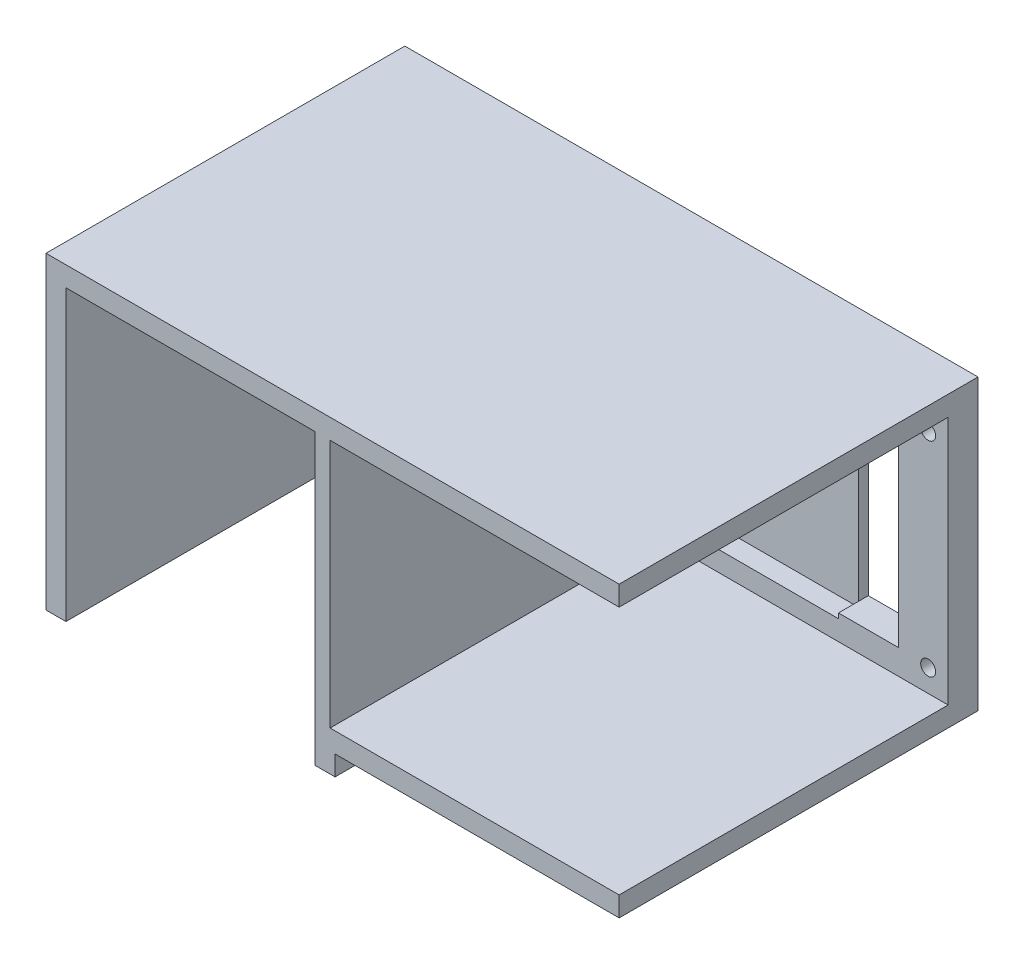
from build123d import *

# Parameters (mm, degrees)
EXTRUDE_1_DEPTH     = 3
CUT_EXTRUDE_1_REACH = 67.393
SKETCH_2_R          = 0.75
CUT_EXTRUDE_3_REACH = 67.393
SKETCH_4_W          = 20
SKETCH_4_H          = 6
CUT_EXTRUDE_4_REACH = 67.393
SKETCH_5_W          = 6
SKETCH_5_H          = 20
SKETCH_7_W          = 21
SKETCH_7_H          = 2
CUT_EXTRUDE_6_DEPTH = 13
SKETCH_8_W          = 2
SKETCH_8_H          = 21
CUT_EXTRUDE_7_DEPTH = 13
SKETCH_9_W          = 1.5
SKETCH_9_H          = 25
EXTRUDE_2_DEPTH     = 33


with BuildPart() as part:
    # 草图1 → 凸台-拉伸1 (new body)
    with BuildSketch(Plane.XY):
        Polygon((0, 0), (57.5, 0), (57.5, -29), (29, -29), (29, -31), (0, -31), align=None)
    extrude(amount=EXTRUDE_1_DEPTH)

    # 草图2 → 切除-拉伸1 (cut, up to next)
    with BuildSketch(Plane.XY.offset(3), mode=Mode.PRIVATE) as cut_extrude_1_sk1:
        with Locations((31.05, -4.25)):
            Circle(SKETCH_2_R)
    cut_extrude_1_tool1 = extrude(cut_extrude_1_sk1.sketch, amount=-CUT_EXTRUDE_1_REACH, mode=Mode.PRIVATE) & part.part
    # 草图2 → 切除-拉伸1 (cut, up to next)
    with BuildSketch(Plane.XY.offset(3), mode=Mode.PRIVATE) as cut_extrude_1_sk2:
        with Locations((55.5, -4.25)):
            Circle(SKETCH_2_R)
    cut_extrude_1_tool2 = extrude(cut_extrude_1_sk2.sketch, amount=-CUT_EXTRUDE_1_REACH, mode=Mode.PRIVATE) & part.part
    # 草图2 → 切除-拉伸1 (cut, up to next)
    with BuildSketch(Plane.XY.offset(3), mode=Mode.PRIVATE) as cut_extrude_1_sk3:
        with Locations((31.05, -24.75)):
            Circle(SKETCH_2_R)
    cut_extrude_1_tool3 = extrude(cut_extrude_1_sk3.sketch, amount=-CUT_EXTRUDE_1_REACH, mode=Mode.PRIVATE) & part.part
    # 草图2 → 切除-拉伸1 (cut, up to next)
    with BuildSketch(Plane.XY.offset(3), mode=Mode.PRIVATE) as cut_extrude_1_sk4:
        with Locations((55.5, -24.75)):
            Circle(SKETCH_2_R)
    cut_extrude_1_tool4 = extrude(cut_extrude_1_sk4.sketch, amount=-CUT_EXTRUDE_1_REACH, mode=Mode.PRIVATE) & part.part
    # 草图2 → 切除-拉伸1 (cut, up to next)
    with BuildSketch(Plane.XY.offset(3), mode=Mode.PRIVATE) as cut_extrude_1_sk5:
        with Locations((4.25, -29)):
            Circle(SKETCH_2_R)
    cut_extrude_1_tool5 = extrude(cut_extrude_1_sk5.sketch, amount=-CUT_EXTRUDE_1_REACH, mode=Mode.PRIVATE) & part.part
    # 草图2 → 切除-拉伸1 (cut, up to next)
    with BuildSketch(Plane.XY.offset(3), mode=Mode.PRIVATE) as cut_extrude_1_sk6:
        with Locations((24.75, -29)):
            Circle(SKETCH_2_R)
    cut_extrude_1_tool6 = extrude(cut_extrude_1_sk6.sketch, amount=-CUT_EXTRUDE_1_REACH, mode=Mode.PRIVATE) & part.part
    # 草图2 → 切除-拉伸1 (cut, up to next)
    with BuildSketch(Plane.XY.offset(3), mode=Mode.PRIVATE) as cut_extrude_1_sk7:
        with Locations((4.25, -4.55)):
            Circle(SKETCH_2_R)
    cut_extrude_1_tool7 = extrude(cut_extrude_1_sk7.sketch, amount=-CUT_EXTRUDE_1_REACH, mode=Mode.PRIVATE) & part.part
    # 草图2 → 切除-拉伸1 (cut, up to next)
    with BuildSketch(Plane.XY.offset(3), mode=Mode.PRIVATE) as cut_extrude_1_sk8:
        with Locations((24.75, -4.55)):
            Circle(SKETCH_2_R)
    cut_extrude_1_tool8 = extrude(cut_extrude_1_sk8.sketch, amount=-CUT_EXTRUDE_1_REACH, mode=Mode.PRIVATE) & part.part
    add(cut_extrude_1_tool1.solids().sort_by_distance((31.05, -4.25, 3))[0], mode=Mode.SUBTRACT)
    add(cut_extrude_1_tool2.solids().sort_by_distance((55.5, -4.25, 3))[0], mode=Mode.SUBTRACT)
    add(cut_extrude_1_tool3.solids().sort_by_distance((31.05, -24.75, 3))[0], mode=Mode.SUBTRACT)
    add(cut_extrude_1_tool4.solids().sort_by_distance((55.5, -24.75, 3))[0], mode=Mode.SUBTRACT)
    add(cut_extrude_1_tool5.solids().sort_by_distance((4.25, -29, 3))[0], mode=Mode.SUBTRACT)
    add(cut_extrude_1_tool6.solids().sort_by_distance((24.75, -29, 3))[0], mode=Mode.SUBTRACT)
    add(cut_extrude_1_tool7.solids().sort_by_distance((4.25, -4.55, 3))[0], mode=Mode.SUBTRACT)
    add(cut_extrude_1_tool8.solids().sort_by_distance((24.75, -4.55, 3))[0], mode=Mode.SUBTRACT)

    # 草图4 → 切除-拉伸3 (cut, up to next)
    with BuildSketch(Plane(origin=(0, 0, 0), x_dir=(-1, 0, 0), z_dir=(0, 0, -1)), mode=Mode.PRIVATE) as cut_extrude_3_sk1:
        with Locations((-14.5, -23)):
            Rectangle(SKETCH_4_W, SKETCH_4_H)
    cut_extrude_3_tool1 = extrude(cut_extrude_3_sk1.sketch, amount=-CUT_EXTRUDE_3_REACH, mode=Mode.PRIVATE) & part.part
    add(cut_extrude_3_tool1.solids().sort_by_distance((14.5, -23, 0))[0], mode=Mode.SUBTRACT)

    # 草图5 → 切除-拉伸4 (cut, up to next)
    with BuildSketch(Plane(origin=(0, 0, 0), x_dir=(-1, 0, 0), z_dir=(0, 0, -1)), mode=Mode.PRIVATE) as cut_extrude_4_sk1:
        with Locations((-49.5, -14.5)):
            Rectangle(SKETCH_5_W, SKETCH_5_H)
    cut_extrude_4_tool1 = extrude(cut_extrude_4_sk1.sketch, amount=-CUT_EXTRUDE_4_REACH, mode=Mode.PRIVATE) & part.part
    add(cut_extrude_4_tool1.solids().sort_by_distance((49.5, -14.5, 0))[0], mode=Mode.SUBTRACT)

    # 草图7 → 切除-拉伸6 (cut)
    with BuildSketch(Plane.XZ.offset(20)):
        with Locations((14.5, 2)):
            Rectangle(SKETCH_7_W, SKETCH_7_H)
    extrude(amount=-CUT_EXTRUDE_6_DEPTH, mode=Mode.SUBTRACT)

    # 草图8 → 切除-拉伸7 (cut)
    with BuildSketch(Plane(origin=(46.5, 0, 0), x_dir=(0, 0, -1), z_dir=(1, 0, 0))):
        with Locations((-2, -14.5)):
            Rectangle(SKETCH_8_W, SKETCH_8_H)
    extrude(amount=-CUT_EXTRUDE_7_DEPTH, mode=Mode.SUBTRACT)

    # 草图9 → 凸台-拉伸2 (add)
    with BuildSketch(Plane.XY.offset(3)):
        Polygon((0, -31), (2, -31), (2, -2), (27, -2), (28.5, -2), (57.5, -2), (57.5, 0), (0, 0), align=None)
        with Locations((27.75, -14.5)):
            Rectangle(SKETCH_9_W, SKETCH_9_H)
        Polygon((27, -27), (27, -31), (29, -31), (29, -29), (57.5, -29), (57.5, -27), (28.5, -27), align=None)
    extrude(amount=EXTRUDE_2_DEPTH)


solid = part.part
